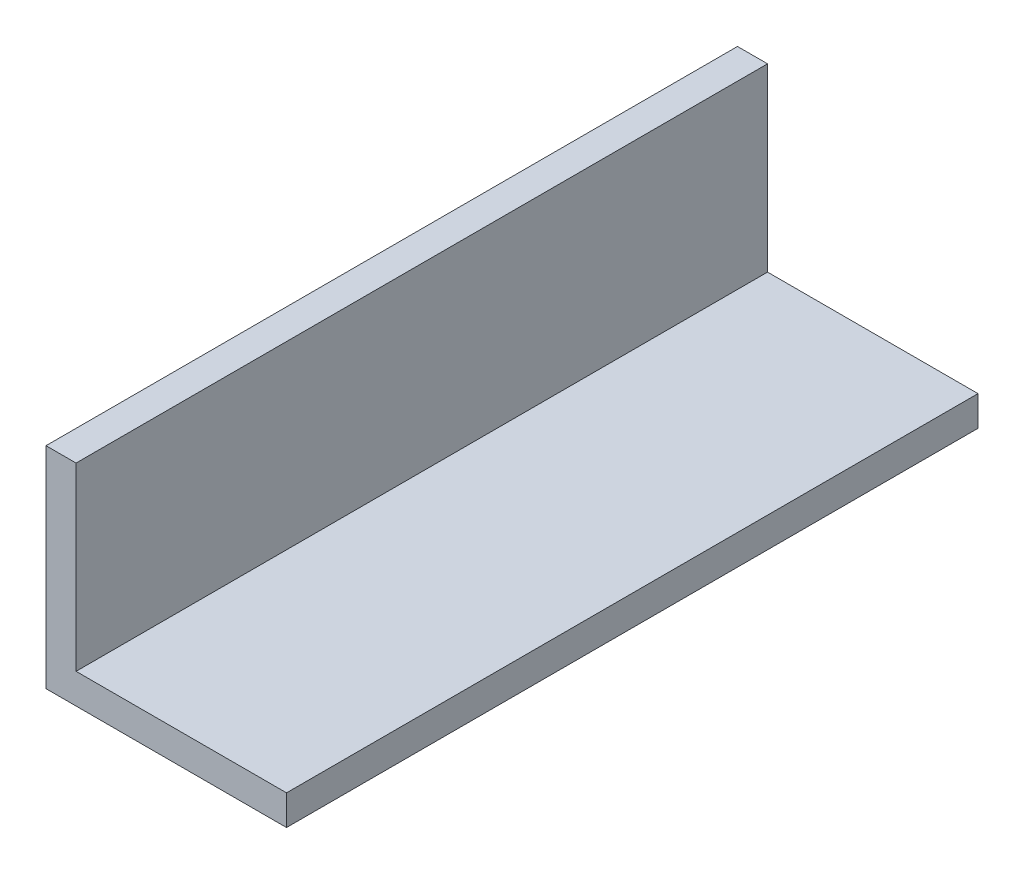
from build123d import *

# Parameters (mm, degrees)
BOSS_EXTRU_1_DEPTH = 115


with BuildPart() as part:
    # Esquisse2 → Boss.-Extru.1 (new body)
    with BuildSketch(Plane(origin=(0, 0, 0), x_dir=(0, 1, 0), z_dir=(0, 0, 1))):
        Polygon((0, 35), (30, 35), (30, 40), (-5, 40), (-5, 35), (-5, 0), (0, 0), (0, 5), align=None)
    extrude(amount=BOSS_EXTRU_1_DEPTH)


solid = part.part
